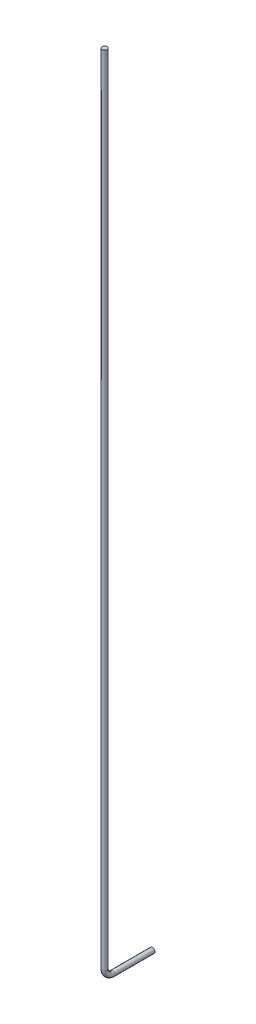
from build123d import *

# Parameters (mm, degrees)
SKETCH_1_R      = 1.6
EXTRUDE_1_DEPTH = 20
SKETCH_2_R      = 1.6


with BuildPart() as part:
    # ｽｹｯﾁ1 → ﾎﾞｽ - 押し出し1 (new body)
    with BuildSketch(Plane.XY):
        Circle(SKETCH_1_R)
    extrude(amount=EXTRUDE_1_DEPTH)

    # ｽｲｰﾌﾟ1: sweep along a path in ｽｹｯﾁ3
    with BuildLine(Plane(origin=(0, 0, 0), x_dir=(0, 0, -1), z_dir=(1, 0, 0))) as sweep_1_path:
        Line((-20, 0), (-25, 0))
        ThreePointArc((-25, 0), (-28.535533906, 1.464466094), (-30, 5))
        Line((-30, 5), (-30, 505))
    # ｽｹｯﾁ2 → ｽｲｰﾌﾟ1 (sweep)
    with BuildSketch(Plane.XY.offset(20)):
        Circle(SKETCH_2_R)
    sweep(path=sweep_1_path.line)


solid = part.part
